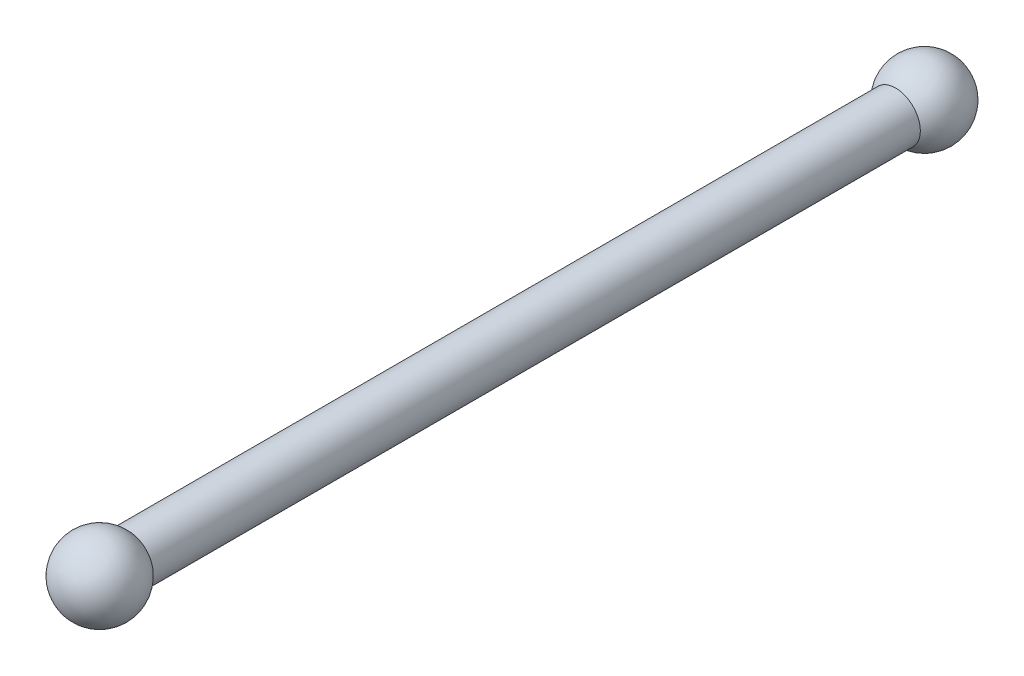
from build123d import *


with BuildPart() as part:
    # Sketch1 → Revolve1 (revolve)
    with BuildSketch(Plane(origin=(0, 0, 0), x_dir=(1, 0, 0), z_dir=(0, 1, 0))):
        with BuildLine():
            Line((0, 292.1), (0, -6642.1))
            ThreePointArc((0, -6642.1), (273.863758624, -6451.592577053), (190.5, -6128.567933668))
            Line((190.5, -6128.567933668), (190.5, -221.432066332))
            ThreePointArc((190.5, -221.432066332), (273.863758624, 101.592577053), (0, 292.1))
        make_face()
    revolve(axis=Axis((0, 0, -292.1), (0, 0, 1)))


solid = part.part
